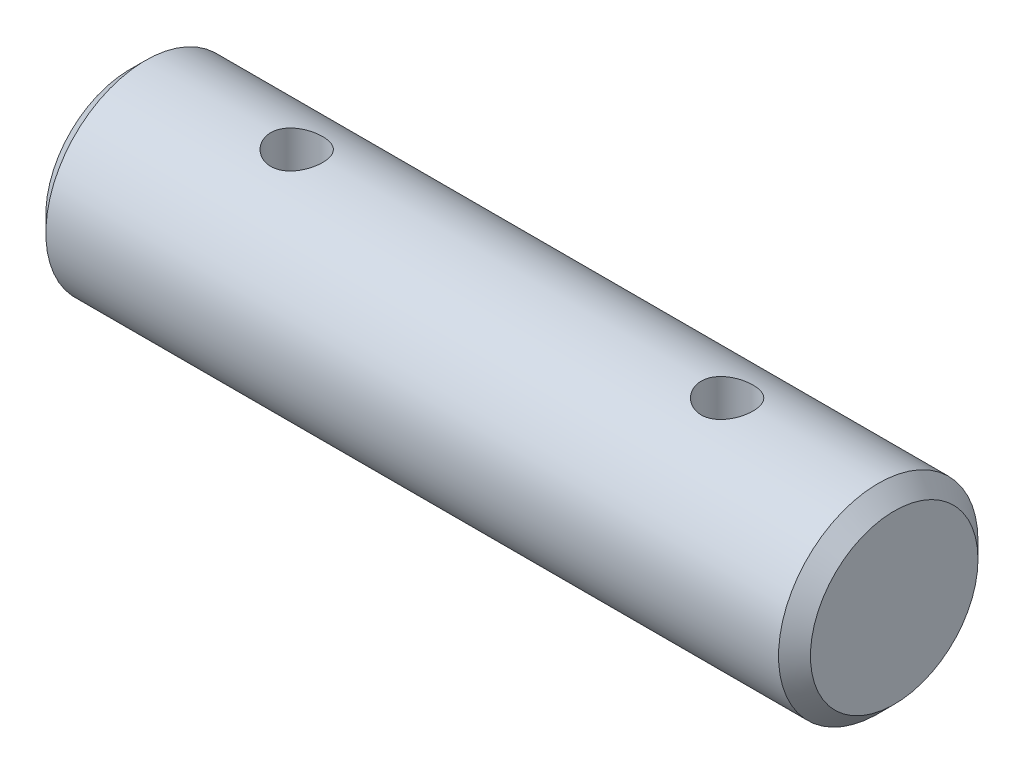
from build123d import *

# Parameters (mm, degrees)
ESBO_O1_R                  = 12.5
RESSALTO_EXTRUS_O1_DEPTH   = 47.91
CHANFRO1_SIZE              = 2
CORTE_EXTRUS_O1_DEPTH      = 52.067289922
CORTE_EXTRUS_O1_DEPTH_BACK = 52.067289922
ESBO_O2_R                  = 3.25


with BuildPart() as part:
    # Esboço1 → Ressalto-extrusão1 (new, symmetric)
    with BuildSketch(Plane(origin=(0, 0, 0), x_dir=(0, -1, 0), z_dir=(1, 0, 0))):
        with Locations(Location((0, 0, 0), (0, 0, 90))):
            Circle(ESBO_O1_R)
    extrude(amount=RESSALTO_EXTRUS_O1_DEPTH, both=True)

    # Chanfro1
    chanfro1_edges = [part.edges().sort_by_distance(p)[0] for p in [
        (-47.91, 0, 12.5),
        (47.91, 0, 12.5),
    ]]
    chamfer(chanfro1_edges, length=CHANFRO1_SIZE)

    # Esboço2 → Corte-extrusão1 (cut, two sides: drawn at the far end of the back side and taken through both)
    with BuildSketch(Plane(origin=(0, 0, 0), x_dir=(1, 0, 0), z_dir=(0, 1, 0)).offset(-CORTE_EXTRUS_O1_DEPTH_BACK)):
        with Locations(Location((-26.97, 0, 0), (0, 0, 270))):
            Circle(ESBO_O2_R)
        with Locations(Location((26.97, 0, 0), (0, 0, 270))):
            Circle(ESBO_O2_R)
    extrude(amount=CORTE_EXTRUS_O1_DEPTH + CORTE_EXTRUS_O1_DEPTH_BACK, mode=Mode.SUBTRACT)


solid = part.part
